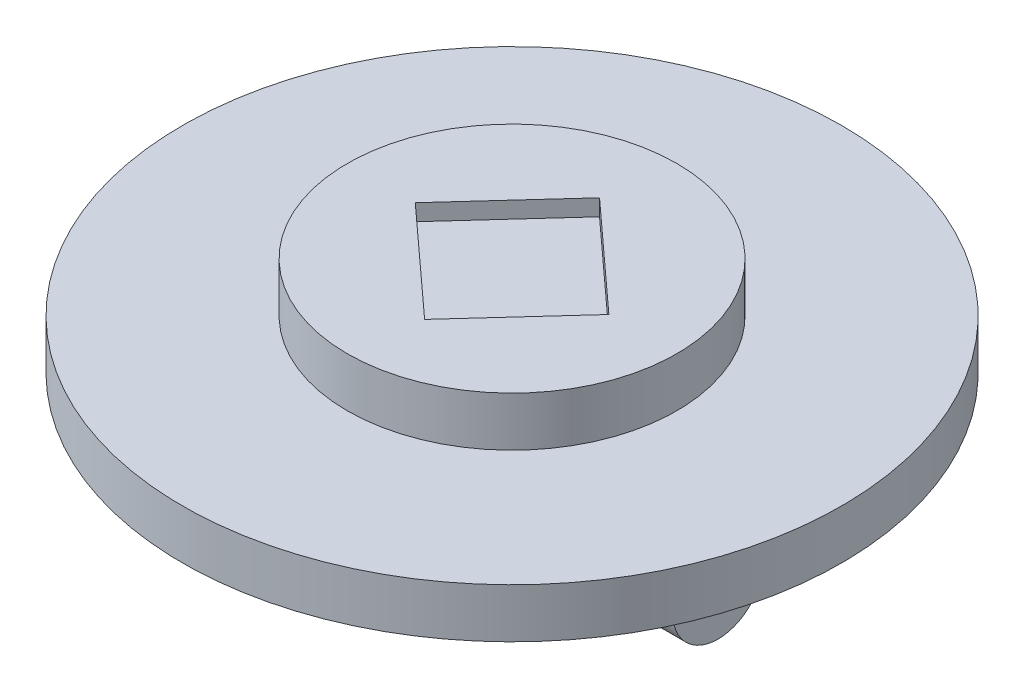
from build123d import *

# Parameters (mm, degrees)
SKETCH1_R           = 50.8
BOSS_EXTRUDE1_DEPTH = 7.62
SKETCH2_W           = 5.08
SKETCH2_H           = 13.97
BOSS_EXTRUDE2_DEPTH = 12.7
SKETCH3_R           = 6.985
BOSS_EXTRUDE3_DEPTH = 5.08
SKETCH4_R           = 2.516115175
CUT_EXTRUDE1_DEPTH  = 5.08
SKETCH5_W           = 5.08
SKETCH5_H           = 13.97
BOSS_EXTRUDE4_DEPTH = 12.7
BOSS_EXTRUDE5_START = -5.08
SKETCH6_R           = 6.985
BOSS_EXTRUDE5_DEPTH = 5.08
SKETCH8_R           = 2.54
CUT_EXTRUDE2_DEPTH  = 5.08
SKETCH9_R           = 25.4
BOSS_EXTRUDE6_DEPTH = 7.62
CUT_EXTRUDE3_DEPTH  = 2.54


with BuildPart() as part:
    # Sketch1 → Boss-Extrude1 (new body)
    with BuildSketch(Plane(origin=(0, 0, 0), x_dir=(1, 0, 0), z_dir=(0, 1, 0))):
        with Locations(Location((0, 0, 0), (0, 0, 90))):
            Circle(SKETCH1_R)
    extrude(amount=BOSS_EXTRUDE1_DEPTH)

    # Sketch2 → Boss-Extrude2 (add)
    with BuildSketch(Plane.XZ):
        with Locations((-29.21, 0)):
            Rectangle(SKETCH2_W, SKETCH2_H)
    extrude(amount=BOSS_EXTRUDE2_DEPTH)

    # Sketch3 → Boss-Extrude3 (add)
    with BuildSketch(Plane.ZY.offset(31.75)):
        with Locations((0, -12.7)):
            Circle(SKETCH3_R)
    extrude(amount=-BOSS_EXTRUDE3_DEPTH)

    # Sketch4 → Cut-Extrude1 (cut)
    with BuildSketch(Plane.ZY.offset(31.75)):
        with Locations((0, -12.7)):
            Circle(SKETCH4_R)
    extrude(amount=-CUT_EXTRUDE1_DEPTH, mode=Mode.SUBTRACT)

    # Sketch5 → Boss-Extrude4 (add)
    with BuildSketch(Plane.XZ):
        with Locations((29.21, 0)):
            Rectangle(SKETCH5_W, SKETCH5_H)
    extrude(amount=BOSS_EXTRUDE4_DEPTH)

    # Sketch6 → Boss-Extrude5 (add)
    with BuildSketch(Plane(origin=(31.75, 0, 0), x_dir=(0, 0, -1), z_dir=(1, 0, 0)).offset(BOSS_EXTRUDE5_START)):
        with Locations((0, -12.7)):
            Circle(SKETCH6_R)
    extrude(amount=BOSS_EXTRUDE5_DEPTH)

    # Sketch8 → Cut-Extrude2 (cut)
    with BuildSketch(Plane(origin=(31.75, 0, 0), x_dir=(0, 0, -1), z_dir=(1, 0, 0))):
        with Locations((0, -12.7)):
            Circle(SKETCH8_R)
    extrude(amount=-CUT_EXTRUDE2_DEPTH, mode=Mode.SUBTRACT)

    # Sketch9 → Boss-Extrude6 (add)
    with BuildSketch(Plane(origin=(0, 7.62, 0), x_dir=(1, 0, 0), z_dir=(0, 1, 0))):
        with Locations(Location((0, 0, 0), (0, 0, 90))):
            Circle(SKETCH9_R)
    extrude(amount=BOSS_EXTRUDE6_DEPTH)

    # Sketch10 → Cut-Extrude3 (cut)
    with BuildSketch(Plane(origin=(0, 15.24, 0), x_dir=(1, 0, 0), z_dir=(0, 1, 0))):
        Polygon((1.37873117, -14.858671092), (-14.9225, 0), (-1.37873117, 14.858671092), (14.9225, 0), align=None)
    extrude(amount=-CUT_EXTRUDE3_DEPTH, mode=Mode.SUBTRACT)


solid = part.part
